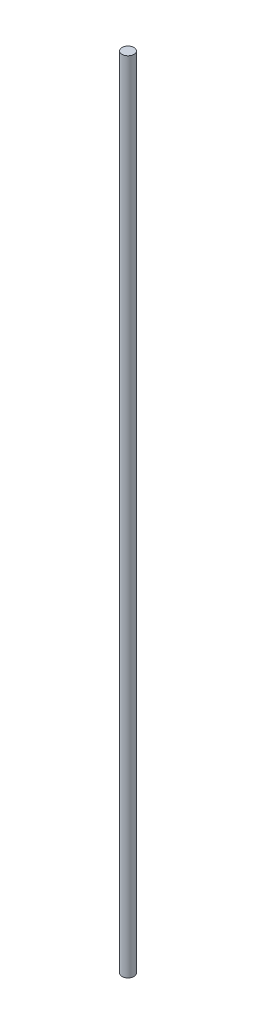
from build123d import *

# Parameters (mm, degrees)
CROQUIS1_R     = 7.5
EXTRUIR1_DEPTH = 1000


with BuildPart() as part:
    # Croquis1 → Extruir1 (new body)
    with BuildSketch(Plane(origin=(0, 0, 0), x_dir=(1, 0, 0), z_dir=(0, 1, 0))):
        with Locations(Location((0, 0, 0), (0, 0, 270))):
            Circle(CROQUIS1_R)
    extrude(amount=EXTRUIR1_DEPTH)


solid = part.part
